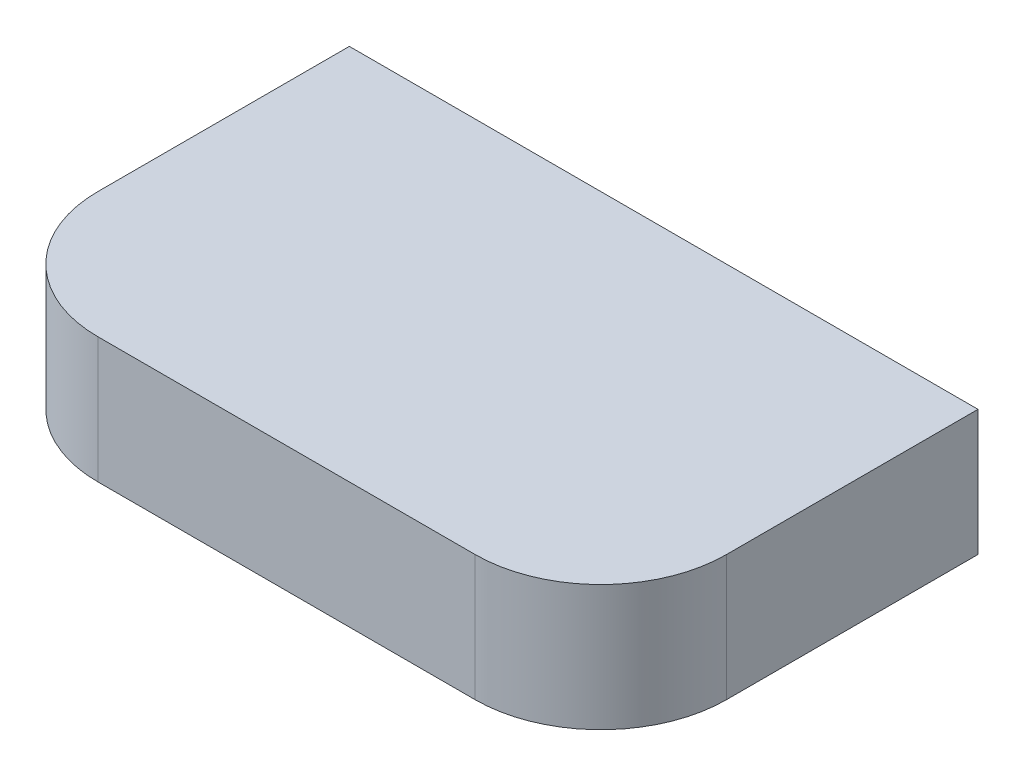
from build123d import *

# Parameters (mm, degrees)
SKETCH1_W           = 100
SKETCH1_H           = 60
BOSS_EXTRUDE1_DEPTH = 20
FILLET1_R           = 20


with BuildPart() as part:
    # Sketch1 → Boss-Extrude1 (new body)
    with BuildSketch(Plane(origin=(0, 0, 0), x_dir=(1, 0, 0), z_dir=(0, 1, 0))):
        with Locations((50, -30)):
            Rectangle(SKETCH1_W, SKETCH1_H)
    extrude(amount=BOSS_EXTRUDE1_DEPTH)

    # Fillet1
    fillet1_edges = [part.edges().sort_by_distance(p)[0] for p in [
        (100, 10, 60),
        (0, 10, 60),
    ]]
    fillet(fillet1_edges, radius=FILLET1_R)


solid = part.part
